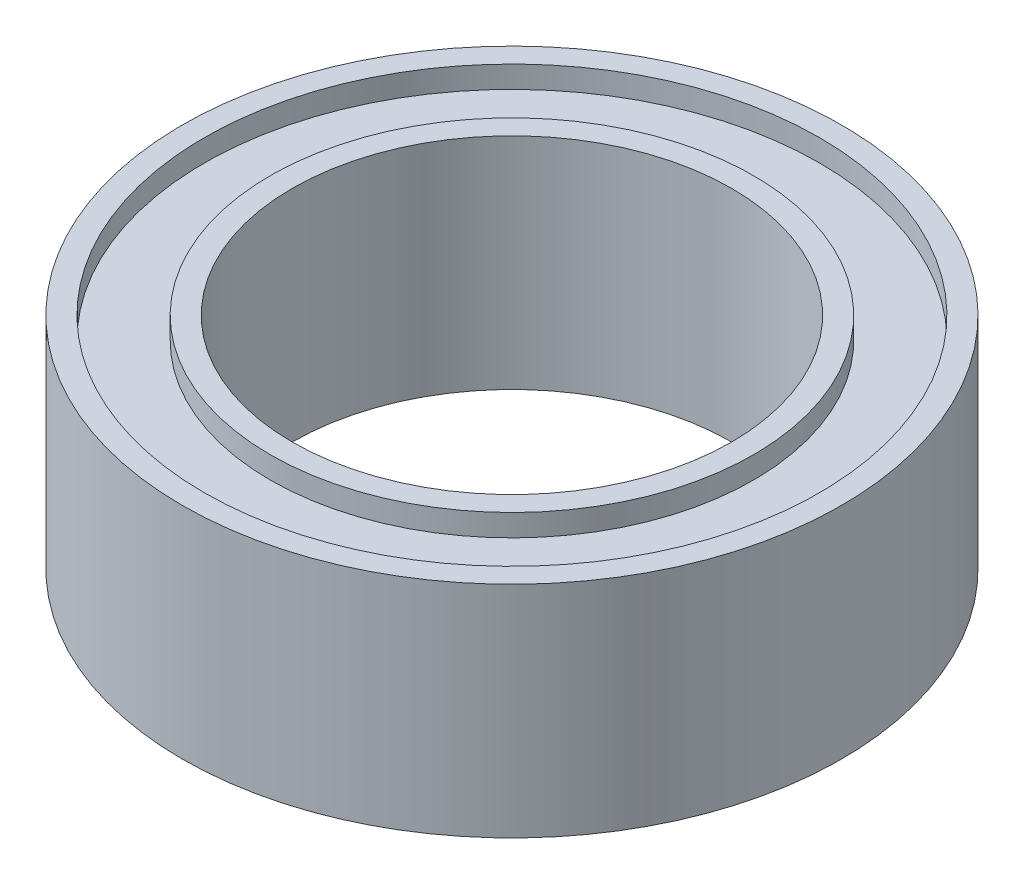
from build123d import *

# Parameters (mm, degrees)
SKETCH1_R           = 7.5
SKETCH1_R_2         = 5
BOSS_EXTRUDE1_DEPTH = 5
SKETCH2_R           = 7
SKETCH2_R_2         = 5.5
CUT_EXTRUDE1_DEPTH  = 0.5


with BuildPart() as part:
    # Sketch1 → Boss-Extrude1 (new body)
    with BuildSketch(Plane(origin=(0, 0, 0), x_dir=(1, 0, 0), z_dir=(0, 1, 0))):
        with Locations(Location((0, 0, 0), (0, 0, 270))):
            Circle(SKETCH1_R)
        with Locations(Location((0, 0, 0), (0, 0, 270))):
            Circle(SKETCH1_R_2, mode=Mode.SUBTRACT)
    extrude(amount=BOSS_EXTRUDE1_DEPTH)

    # Sketch2 → Cut-Extrude1 (cut)
    with BuildSketch(Plane(origin=(0, 5, 0), x_dir=(1, 0, 0), z_dir=(0, 1, 0))):
        with Locations(Location((0, 0, 0), (0, 0, 270))):
            Circle(SKETCH2_R)
        with Locations(Location((0, 0, 0), (0, 0, 270))):
            Circle(SKETCH2_R_2, mode=Mode.SUBTRACT)
    cut_extrude1 = extrude(amount=-CUT_EXTRUDE1_DEPTH, mode=Mode.SUBTRACT)

    # Mirror1: Cut-Extrude1 across plane
    add(cut_extrude1.mirror(Plane(origin=(0, 2.5, 0), x_dir=(0, 0, 1), z_dir=(0, -1, 0))), mode=Mode.SUBTRACT)


solid = part.part
